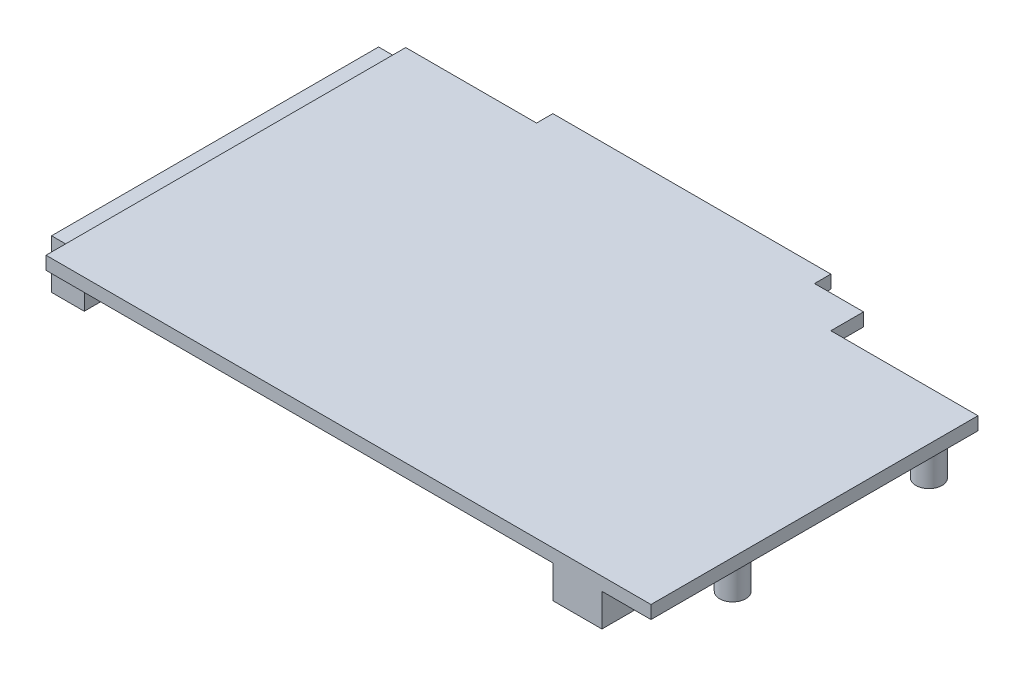
from build123d import *

# Parameters (mm, degrees)
SKETCH1_W           = 185
SKETCH1_H           = 100
BOSS_EXTRUDE1_DEPTH = 4
BOSS_EXTRUDE2_DEPTH = 4
SKETCH3_W           = 10
SKETCH3_H           = 100
BOSS_EXTRUDE3_DEPTH = 15
SKETCH4_W           = 20
SKETCH4_H           = 70
BOSS_EXTRUDE4_DEPTH = 6
SKETCH5_W           = 15
SKETCH5_H           = 20
BOSS_EXTRUDE5_DEPTH = 10
SKETCH6_R           = 4
BOSS_EXTRUDE6_DEPTH = 10


with BuildPart() as part:
    # Sketch1 → Boss-Extrude1 (new body)
    with BuildSketch(Plane(origin=(0, 0, 0), x_dir=(1, 0, 0), z_dir=(0, 1, 0))):
        with Locations((92.5, 50)):
            Rectangle(SKETCH1_W, SKETCH1_H)
    extrude(amount=BOSS_EXTRUDE1_DEPTH)

    # Sketch2 → Boss-Extrude2 (add)
    with BuildSketch(Plane(origin=(0, 4, 0), x_dir=(-1, 0, 0), z_dir=(0, 1, 0))):
        Polygon((-40, -115), (-40, -110), (0, -110), (0, -100), (-140, -100), (-140, -110), (-125, -110), (-125, -115), align=None)
    extrude(amount=-BOSS_EXTRUDE2_DEPTH)

    # Sketch3 → Boss-Extrude3 (add)
    with BuildSketch(Plane.XZ):
        with Locations((-3.300721775, -60)):
            Rectangle(SKETCH3_W, SKETCH3_H)
    extrude(amount=BOSS_EXTRUDE3_DEPTH)

    # Sketch4 → Boss-Extrude4 (add)
    with BuildSketch(Plane.XZ):
        with Locations((137.629312938, -55)):
            Rectangle(SKETCH4_W, SKETCH4_H)
    extrude(amount=BOSS_EXTRUDE4_DEPTH)

    # Sketch5 → Boss-Extrude5 (add)
    with BuildSketch(Plane.XZ):
        with Locations((162.5, -10)):
            Rectangle(SKETCH5_W, SKETCH5_H)
    extrude(amount=BOSS_EXTRUDE5_DEPTH)

    # Sketch6 → Boss-Extrude6 (add)
    with BuildSketch(Plane.XZ):
        with Locations(Location((180, -30, 0), (0, 0, 270))):
            Circle(SKETCH6_R)
        with Locations(Location((180, -90, 0), (0, 0, 270))):
            Circle(SKETCH6_R)
    extrude(amount=BOSS_EXTRUDE6_DEPTH)


solid = part.part
